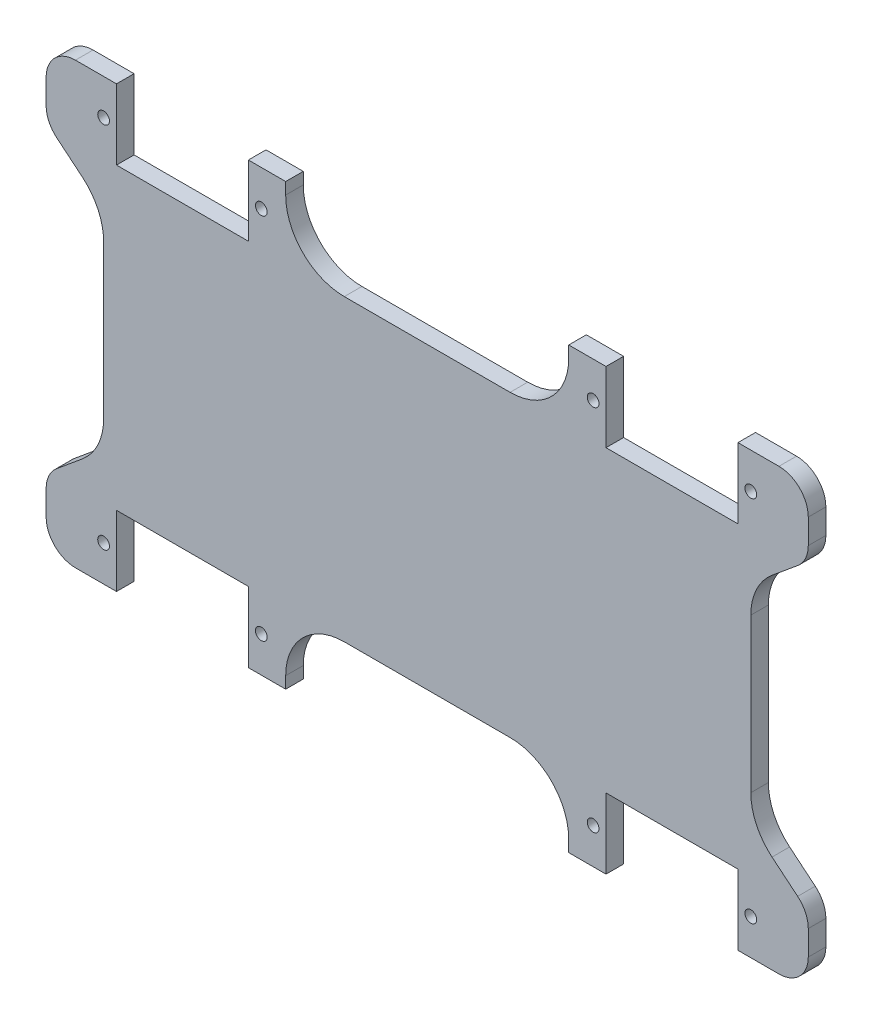
from build123d import *

# Parameters (mm, degrees)
SKETCH1_R           = 1
BOSS_EXTRUDE1_DEPTH = 1.5


with BuildPart() as part:
    # Sketch1 → Boss-Extrude1 (new, symmetric)
    with BuildSketch(Plane.XY):
        with BuildLine():
            Line((30.5, 37.5), (30.5, 25.5))
            Line((30.5, 25.5), (53, 25.5))
            Line((53, 25.5), (53, 37.5))
            Line((53, 37.5), (60, 37.5))
            ThreePointArc((60, 37.5), (63.535533906, 36.035533906), (65, 32.5))
            Line((65, 32.5), (65, 28.283390528))
            ThreePointArc((65, 28.283390528), (64.524852545, 26.15601904), (63.189716221, 24.432973612))
            Line((63.189716221, 24.432973612), (58.820567558, 20.813535857))
            ThreePointArc((58.820567558, 20.813535857), (56.15029491, 17.367445), (55.2, 13.112702024))
            Line((55.2, 13.112702024), (55.2, -13.112702024))
            ThreePointArc((55.2, -13.112702024), (56.15029491, -17.367445), (58.820567558, -20.813535857))
            Line((58.820567558, -20.813535857), (63.189716221, -24.432973612))
            ThreePointArc((63.189716221, -24.432973612), (64.524852545, -26.15601904), (65, -28.283390528))
            Line((65, -28.283390528), (65, -32.5))
            ThreePointArc((65, -32.5), (63.535533906, -36.035533906), (60, -37.5))
            Line((60, -37.5), (53, -37.5))
            Line((53, -37.5), (53, -25.5))
            Line((53, -25.5), (30.5, -25.5))
            Line((30.5, -25.5), (30.5, -37.5))
            Line((30.5, -37.5), (24.141964056, -37.5))
            Line((24.141964056, -37.5), (24.141964056, -35.5))
            ThreePointArc((24.141964056, -35.5), (21.213031868, -28.428932188), (14.141964056, -25.5))
            Line((14.141964056, -25.5), (-14.141964056, -25.5))
            ThreePointArc((-14.141964056, -25.5), (-21.213031868, -28.428932188), (-24.141964056, -35.5))
            Line((-24.141964056, -35.5), (-24.141964056, -37.5))
            Line((-24.141964056, -37.5), (-30.5, -37.5))
            Line((-30.5, -37.5), (-30.5, -25.5))
            Line((-30.5, -25.5), (-53, -25.5))
            Line((-53, -25.5), (-53, -37.5))
            Line((-53, -37.5), (-60, -37.5))
            ThreePointArc((-60, -37.5), (-63.535533906, -36.035533906), (-65, -32.5))
            Line((-65, -32.5), (-65, -28.283390528))
            ThreePointArc((-65, -28.283390528), (-64.524852545, -26.15601904), (-63.189716221, -24.432973612))
            Line((-63.189716221, -24.432973612), (-58.820567558, -20.813535857))
            ThreePointArc((-58.820567558, -20.813535857), (-56.15029491, -17.367445), (-55.2, -13.112702024))
            Line((-55.2, -13.112702024), (-55.2, 13.112702024))
            ThreePointArc((-55.2, 13.112702024), (-56.15029491, 17.367445), (-58.820567558, 20.813535857))
            Line((-58.820567558, 20.813535857), (-63.189716221, 24.432973612))
            ThreePointArc((-63.189716221, 24.432973612), (-64.524852545, 26.15601904), (-65, 28.283390528))
            Line((-65, 28.283390528), (-65, 32.5))
            ThreePointArc((-65, 32.5), (-63.535533906, 36.035533906), (-60, 37.5))
            Line((-60, 37.5), (-53, 37.5))
            Line((-53, 37.5), (-53, 25.5))
            Line((-53, 25.5), (-30.5, 25.5))
            Line((-30.5, 25.5), (-30.5, 37.5))
            Line((-30.5, 37.5), (-24.141964056, 37.5))
            Line((-24.141964056, 37.5), (-24.141964056, 35.5))
            ThreePointArc((-24.141964056, 35.5), (-21.213031868, 28.428932188), (-14.141964056, 25.5))
            Line((-14.141964056, 25.5), (14.141964056, 25.5))
            ThreePointArc((14.141964056, 25.5), (21.213031868, 28.428932188), (24.141964056, 35.5))
            Line((24.141964056, 35.5), (24.141964056, 37.5))
            Line((24.141964056, 37.5), (30.5, 37.5))
        make_face()
        with Locations((55.2, 31.4)):
            Circle(SKETCH1_R, mode=Mode.SUBTRACT)
        with Locations(Location((28.3, 31.4, 0), (0, 0, 180))):
            Circle(SKETCH1_R, mode=Mode.SUBTRACT)
        with Locations((-28.3, 31.4)):
            Circle(SKETCH1_R, mode=Mode.SUBTRACT)
        with Locations(Location((-28.3, -31.4, 0), (0, 0, 180))):
            Circle(SKETCH1_R, mode=Mode.SUBTRACT)
        with Locations((28.3, -31.4)):
            Circle(SKETCH1_R, mode=Mode.SUBTRACT)
        with Locations(Location((55.2, -31.4, 0), (0, 0, 180))):
            Circle(SKETCH1_R, mode=Mode.SUBTRACT)
        with Locations(Location((-55.2, 31.4, 0), (0, 0, 180))):
            Circle(SKETCH1_R, mode=Mode.SUBTRACT)
        with Locations((-55.2, -31.4)):
            Circle(SKETCH1_R, mode=Mode.SUBTRACT)
    extrude(amount=BOSS_EXTRUDE1_DEPTH, both=True)


solid = part.part
